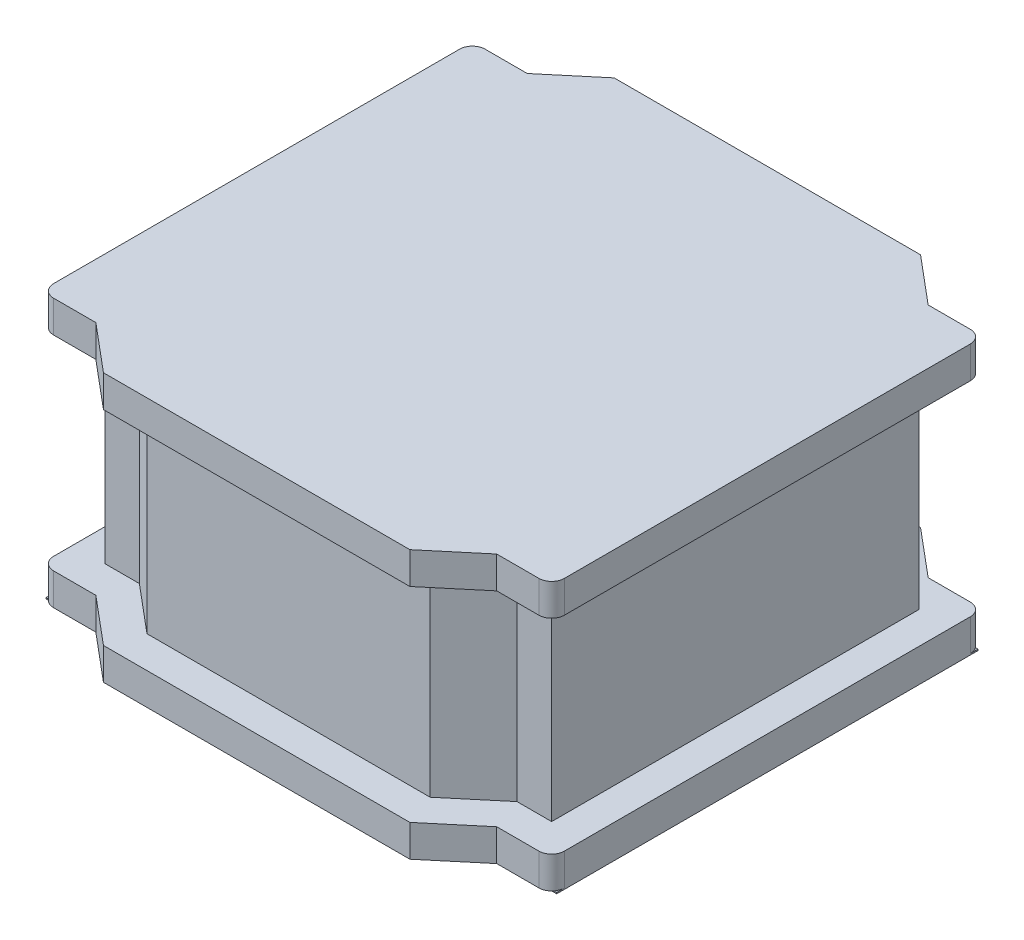
from build123d import *

# Parameters (mm, degrees)
SALIENTE_EXTRUIR1_DEPTH = 0.25
SALIENTE_EXTRUIR3_DEPTH = 1.6
SALIENTE_EXTRUIR2_DEPTH = 0.25
CROQUIS4_W              = 1
CROQUIS4_H              = 3.3
SALIENTE_EXTRUIR4_DEPTH = 0.01


with BuildPart() as part:
    # Croquis1 → Saliente-Extruir1 (new body)
    with BuildSketch(Plane(origin=(0, 0, 0), x_dir=(1, 0, 0), z_dir=(0, 1, 0))):
        with BuildLine():
            Line((1.287926846, 2), (-1.112073154, 2))
            Line((-1.112073154, 2), (-1.482101523, 1.689509332))
            Line((-1.482101523, 1.689509332), (-1.812073154, 1.689509332))
            ThreePointArc((-1.812073154, 1.689509332), (-1.882783832, 1.66022001), (-1.912073154, 1.589509332))
            Line((-1.912073154, 1.589509332), (-1.912073154, -1.589509332))
            ThreePointArc((-1.912073154, -1.589509332), (-1.882783832, -1.66022001), (-1.812073154, -1.689509332))
            Line((-1.812073154, -1.689509332), (-1.482101523, -1.689509332))
            Line((-1.482101523, -1.689509332), (-1.112073154, -2))
            Line((-1.112073154, -2), (1.287926846, -2))
            Line((1.287926846, -2), (1.657955215, -1.689509332))
            Line((1.657955215, -1.689509332), (1.987926846, -1.689509332))
            ThreePointArc((1.987926846, -1.689509332), (2.058637524, -1.66022001), (2.087926846, -1.589509332))
            Line((2.087926846, -1.589509332), (2.087926846, 1.589509332))
            ThreePointArc((2.087926846, 1.589509332), (2.058637524, 1.66022001), (1.987926846, 1.689509332))
            Line((1.987926846, 1.689509332), (1.657955215, 1.689509332))
            Line((1.657955215, 1.689509332), (1.287926846, 2))
        make_face()
    extrude(amount=SALIENTE_EXTRUIR1_DEPTH)

    # Croquis3 → Saliente-Extruir3 (add)
    with BuildSketch(Plane(origin=(0, 0.25, 0), x_dir=(1, 0, 0), z_dir=(0, 1, 0))):
        Polygon((-1.021080595, -1.75), (1.196934287, -1.75), (1.566962656, -1.439509332), (1.837926846, -1.439509332), (1.837926846, 1.439509332), (1.566962656, 1.439509332), (1.196934287, 1.75), (-1.021080595, 1.75), (-1.391108964, 1.439509332), (-1.662073154, 1.439509332), (-1.662073154, -1.439509332), (-1.391108964, -1.439509332), align=None)
    extrude(amount=SALIENTE_EXTRUIR3_DEPTH)

    # Croquis4 → Saliente-Extruir4 (add)
    with BuildSketch(Plane.XZ):
        with Locations((1.587926846, 0)):
            Rectangle(CROQUIS4_W, CROQUIS4_H)
        with Locations((-1.412073154, 0)):
            Rectangle(CROQUIS4_W, CROQUIS4_H)
    extrude(amount=SALIENTE_EXTRUIR4_DEPTH)


with BuildPart() as body_2:
    # Croquis2 → Saliente-Extruir2 (new body)
    with BuildSketch(Plane(origin=(0, 2.1, 0), x_dir=(1, 0, 0), z_dir=(0, 1, 0))):
        with BuildLine():
            Line((-1.112073154, -2), (1.287926846, -2))
            Line((1.287926846, -2), (1.657955215, -1.689509332))
            Line((1.657955215, -1.689509332), (1.987926846, -1.689509332))
            ThreePointArc((1.987926846, -1.689509332), (2.058637524, -1.66022001), (2.087926846, -1.589509332))
            Line((2.087926846, -1.589509332), (2.087926846, 1.589509332))
            ThreePointArc((2.087926846, 1.589509332), (2.058637524, 1.66022001), (1.987926846, 1.689509332))
            Line((1.987926846, 1.689509332), (1.657955215, 1.689509332))
            Line((1.657955215, 1.689509332), (1.287926846, 2))
            Line((1.287926846, 2), (-1.112073154, 2))
            Line((-1.112073154, 2), (-1.482101523, 1.689509332))
            Line((-1.482101523, 1.689509332), (-1.812073154, 1.689509332))
            ThreePointArc((-1.812073154, 1.689509332), (-1.882783832, 1.66022001), (-1.912073154, 1.589509332))
            Line((-1.912073154, 1.589509332), (-1.912073154, -1.589509332))
            ThreePointArc((-1.912073154, -1.589509332), (-1.882783832, -1.66022001), (-1.812073154, -1.689509332))
            Line((-1.812073154, -1.689509332), (-1.482101523, -1.689509332))
            Line((-1.482101523, -1.689509332), (-1.112073154, -2))
        make_face()
    extrude(amount=-SALIENTE_EXTRUIR2_DEPTH)


solid = Compound([part.part, body_2.part])
